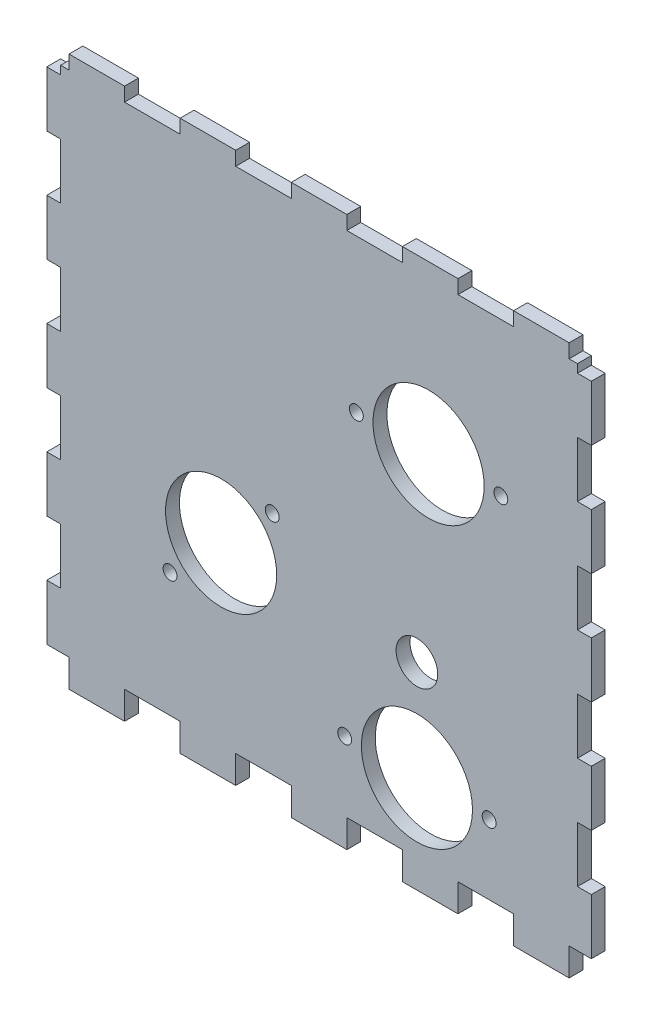
from build123d import *

# Parameters (mm, degrees)
SKETCH_1_W                       = 186
SKETCH_1_H                       = 183
SKETCH_1_R                       = 7.5
SKETCH_1_R_2                     = 20
SKETCH_1_R_3                     = 2.5
EXTRUDE_1_DEPTH                  = 5
SKETCH_2_W                       = 5
SKETCH_2_H                       = 20
EXTRUDE_2_DEPTH                  = 5
PATTERN_LINEAR_2_COUNT           = 5
PATTERN_LINEAR_2_PITCH           = 40
MIRROR_2_COPY_1_SKETCH_W         = 5
MIRROR_2_COPY_1_SKETCH_H         = 20
MIRROR_2_COPY_1_DEPTH            = 5
MIRROR_2_COPY_2_SKETCH_W         = 5
MIRROR_2_COPY_2_SKETCH_H         = 20
MIRROR_2_COPY_2_DEPTH            = 5
MIRROR_2_COPY_3_SKETCH_W         = 5
MIRROR_2_COPY_3_SKETCH_H         = 20
MIRROR_2_COPY_3_DEPTH            = 5
MIRROR_2_COPY_4_SKETCH_W         = 5
MIRROR_2_COPY_4_SKETCH_H         = 20
MIRROR_2_COPY_4_DEPTH            = 5
SKETCH_3_W                       = 20
SKETCH_3_H                       = 5
EXTRUDE_3_DEPTH                  = 5
PATTERN_LINEAR_3_COUNT           = 3
PATTERN_LINEAR_3_PITCH           = 40
PATTERN_LINEAR_4_COUNT           = 3
PATTERN_LINEAR_4_PITCH           = 40
SKETCH_4_W                       = 20
SKETCH_4_H                       = 10
EXTRUDE_4_DEPTH                  = 5
PATTERN_LINEAR_5_COUNT           = 3
PATTERN_LINEAR_5_PITCH           = 40
PATTERN_LINEAR_6_COPY_1_SKETCH_W = 20
PATTERN_LINEAR_6_COPY_1_SKETCH_H = 10
PATTERN_LINEAR_6_COPY_1_DEPTH    = 5
PATTERN_LINEAR_6_COPY_2_SKETCH_W = 20
PATTERN_LINEAR_6_COPY_2_SKETCH_H = 10
PATTERN_LINEAR_6_COPY_2_DEPTH    = 5
PATTERN_LINEAR_6_COPY_3_SKETCH_W = 20
PATTERN_LINEAR_6_COPY_3_SKETCH_H = 10
PATTERN_LINEAR_6_COPY_3_DEPTH    = 5
PATTERN_LINEAR_6_COPY_4_SKETCH_W = 20
PATTERN_LINEAR_6_COPY_4_SKETCH_H = 10
PATTERN_LINEAR_6_COPY_4_DEPTH    = 5
PATTERN_LINEAR_6_COPY_5_SKETCH_W = 20
PATTERN_LINEAR_6_COPY_5_SKETCH_H = 10
PATTERN_LINEAR_6_COPY_5_DEPTH    = 5
PATTERN_LINEAR_6_COPY_6_SKETCH_W = 20
PATTERN_LINEAR_6_COPY_6_SKETCH_H = 10
PATTERN_LINEAR_6_COPY_6_DEPTH    = 5


with BuildPart() as part:
    # 스케치1 → 보스-돌출1 (new body)
    with BuildSketch(Plane.XY):
        Rectangle(SKETCH_1_W, SKETCH_1_H)
        with Locations((35.221625496, -30.5)):
            Circle(SKETCH_1_R, mode=Mode.SUBTRACT)
        with Locations((-35.25, -28.5)):
            Circle(SKETCH_1_R_2, mode=Mode.SUBTRACT)
        with Locations((35.221625496, -66.5)):
            Circle(SKETCH_1_R_2, mode=Mode.SUBTRACT)
        with Locations((39.42261881, 36.5)):
            Circle(SKETCH_1_R_2, mode=Mode.SUBTRACT)
        with Locations((-53.634776311, -46.884776311)):
            Circle(SKETCH_1_R_3, mode=Mode.SUBTRACT)
        with Locations((-16.865223689, -10.115223689)):
            Circle(SKETCH_1_R_3, mode=Mode.SUBTRACT)
        with Locations((65.42261881, 36.5)):
            Circle(SKETCH_1_R_3, mode=Mode.SUBTRACT)
        with Locations((13.42261881, 36.5)):
            Circle(SKETCH_1_R_3, mode=Mode.SUBTRACT)
        with Locations((9.221625496, -66.5)):
            Circle(SKETCH_1_R_3, mode=Mode.SUBTRACT)
        with Locations((61.221625496, -66.5)):
            Circle(SKETCH_1_R_3, mode=Mode.SUBTRACT)
    extrude(amount=EXTRUDE_1_DEPTH)

    # 스케치2 → 보스-돌출2 (add)
    with BuildSketch(Plane.XY.offset(5)):
        with Locations((95.5, -81.5)):
            Rectangle(SKETCH_2_W, SKETCH_2_H)
    extrude_2 = extrude(amount=-EXTRUDE_2_DEPTH)

    # 선형 패턴2: 보스-돌출2 ×5
    with Locations(*[(0, i * PATTERN_LINEAR_2_PITCH, 0) for i in range(1, PATTERN_LINEAR_2_COUNT)]):
        add(extrude_2)

    # 대칭 복사2: 보스-돌출2 across plane
    add(extrude_2.mirror(Plane(origin=(0, 0, 0), x_dir=(0, 0, 1), z_dir=(1, 0, 0))))

    # 대칭 복사2 copy 1 sketch → 대칭 복사2 copy 1 (add)
    with BuildSketch(Plane(origin=(0, 40, 5), x_dir=(-1, 0, 0), z_dir=(0, 0, 1))):
        with Locations((95.5, 81.5)):
            Rectangle(MIRROR_2_COPY_1_SKETCH_W, MIRROR_2_COPY_1_SKETCH_H)
    extrude(amount=-MIRROR_2_COPY_1_DEPTH)

    # 대칭 복사2 copy 2 sketch → 대칭 복사2 copy 2 (add)
    with BuildSketch(Plane(origin=(0, 80, 5), x_dir=(-1, 0, 0), z_dir=(0, 0, 1))):
        with Locations((95.5, 81.5)):
            Rectangle(MIRROR_2_COPY_2_SKETCH_W, MIRROR_2_COPY_2_SKETCH_H)
    extrude(amount=-MIRROR_2_COPY_2_DEPTH)

    # 대칭 복사2 copy 3 sketch → 대칭 복사2 copy 3 (add)
    with BuildSketch(Plane(origin=(0, 120, 5), x_dir=(-1, 0, 0), z_dir=(0, 0, 1))):
        with Locations((95.5, 81.5)):
            Rectangle(MIRROR_2_COPY_3_SKETCH_W, MIRROR_2_COPY_3_SKETCH_H)
    extrude(amount=-MIRROR_2_COPY_3_DEPTH)

    # 대칭 복사2 copy 4 sketch → 대칭 복사2 copy 4 (add)
    with BuildSketch(Plane(origin=(0, 160, 5), x_dir=(-1, 0, 0), z_dir=(0, 0, 1))):
        with Locations((95.5, 81.5)):
            Rectangle(MIRROR_2_COPY_4_SKETCH_W, MIRROR_2_COPY_4_SKETCH_H)
    extrude(amount=-MIRROR_2_COPY_4_DEPTH)

    # 스케치3 → 보스-돌출3 (add)
    with BuildSketch(Plane.XY.offset(5)):
        with Locations((0, 94)):
            Rectangle(SKETCH_3_W, SKETCH_3_H)
    extrude_3 = extrude(amount=-EXTRUDE_3_DEPTH)

    # 선형 패턴3: 보스-돌출3 ×3
    with Locations(*[(i * PATTERN_LINEAR_3_PITCH, 0, 0) for i in range(1, PATTERN_LINEAR_3_COUNT)]):
        add(extrude_3)

    # 선형 패턴4: 보스-돌출3 ×3
    with Locations(*[(-i * PATTERN_LINEAR_4_PITCH, 0, 0) for i in range(1, PATTERN_LINEAR_4_COUNT)]):
        add(extrude_3)

    # 스케치4 → 보스-돌출4 (add)
    with BuildSketch(Plane.XY.offset(5)):
        with Locations((0, -96.5)):
            Rectangle(SKETCH_4_W, SKETCH_4_H)
    extrude_4 = extrude(amount=-EXTRUDE_4_DEPTH)

    # 선형 패턴5: 보스-돌출4 ×3
    with Locations(*[(i * PATTERN_LINEAR_5_PITCH, 0, 0) for i in range(1, PATTERN_LINEAR_5_COUNT)]):
        add(extrude_4)

    # 선형 패턴6 copy 1 sketch → 선형 패턴6 copy 1 (add)
    with BuildSketch(Plane.XY.offset(5)):
        with Locations((0, -96.5)):
            Rectangle(PATTERN_LINEAR_6_COPY_1_SKETCH_W, PATTERN_LINEAR_6_COPY_1_SKETCH_H)
    extrude(amount=-PATTERN_LINEAR_6_COPY_1_DEPTH)

    # 선형 패턴6 copy 2 sketch → 선형 패턴6 copy 2 (add)
    with BuildSketch(Plane(origin=(-40, 0, 5), x_dir=(1, 0, 0), z_dir=(0, 0, 1))):
        with Locations((0, -96.5)):
            Rectangle(PATTERN_LINEAR_6_COPY_2_SKETCH_W, PATTERN_LINEAR_6_COPY_2_SKETCH_H)
    extrude(amount=-PATTERN_LINEAR_6_COPY_2_DEPTH)

    # 선형 패턴6 copy 3 sketch → 선형 패턴6 copy 3 (add)
    with BuildSketch(Plane(origin=(40, 0, 5), x_dir=(1, 0, 0), z_dir=(0, 0, 1))):
        with Locations((0, -96.5)):
            Rectangle(PATTERN_LINEAR_6_COPY_3_SKETCH_W, PATTERN_LINEAR_6_COPY_3_SKETCH_H)
    extrude(amount=-PATTERN_LINEAR_6_COPY_3_DEPTH)

    # 선형 패턴6 copy 4 sketch → 선형 패턴6 copy 4 (add)
    with BuildSketch(Plane.XY.offset(5)):
        with Locations((0, -96.5)):
            Rectangle(PATTERN_LINEAR_6_COPY_4_SKETCH_W, PATTERN_LINEAR_6_COPY_4_SKETCH_H)
    extrude(amount=-PATTERN_LINEAR_6_COPY_4_DEPTH)

    # 선형 패턴6 copy 5 sketch → 선형 패턴6 copy 5 (add)
    with BuildSketch(Plane(origin=(-40, 0, 5), x_dir=(1, 0, 0), z_dir=(0, 0, 1))):
        with Locations((0, -96.5)):
            Rectangle(PATTERN_LINEAR_6_COPY_5_SKETCH_W, PATTERN_LINEAR_6_COPY_5_SKETCH_H)
    extrude(amount=-PATTERN_LINEAR_6_COPY_5_DEPTH)

    # 선형 패턴6 copy 6 sketch → 선형 패턴6 copy 6 (add)
    with BuildSketch(Plane(origin=(-80, 0, 5), x_dir=(1, 0, 0), z_dir=(0, 0, 1))):
        with Locations((0, -96.5)):
            Rectangle(PATTERN_LINEAR_6_COPY_6_SKETCH_W, PATTERN_LINEAR_6_COPY_6_SKETCH_H)
    extrude(amount=-PATTERN_LINEAR_6_COPY_6_DEPTH)


solid = part.part
